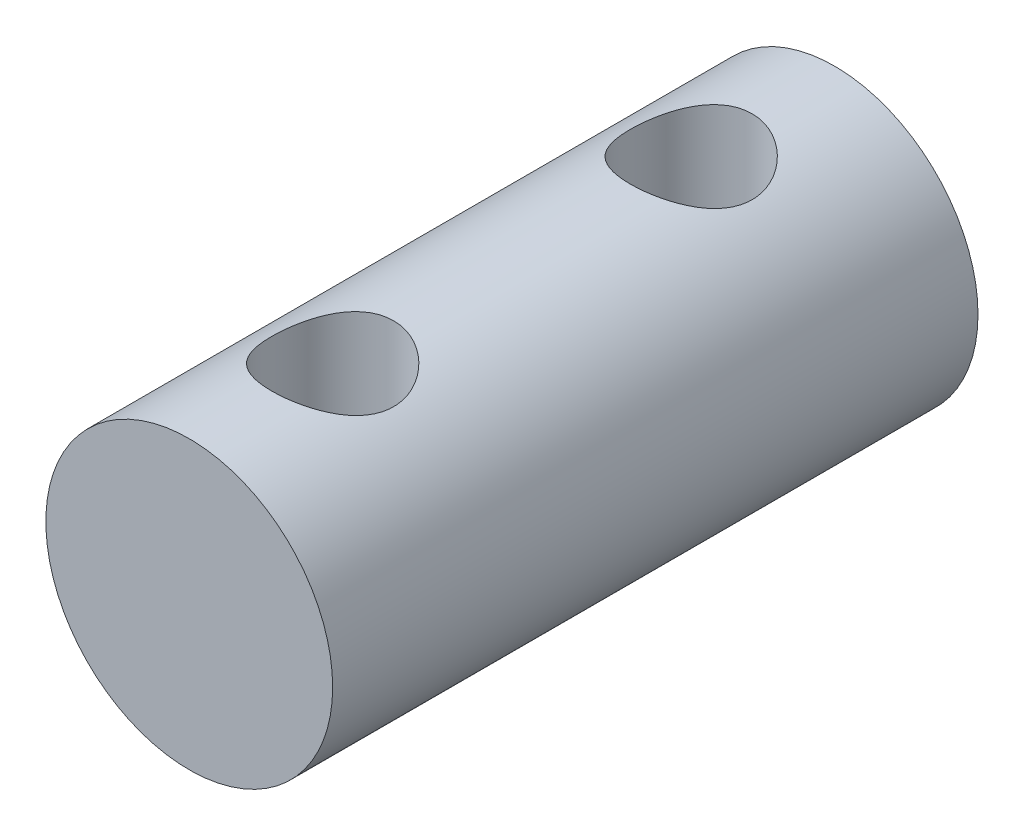
from build123d import *

# Parameters (mm, degrees)
SKETCH_1_R               = 4
EXTRUDE_1_DEPTH          = 18
CUT_EXTRUDE_1_DEPTH      = 10
CUT_EXTRUDE_1_DEPTH_BACK = 10
SKETCH_2_R               = 1.7


with BuildPart() as part:
    # 草图1 → 拉伸1 (new body)
    with BuildSketch(Plane.XY):
        Circle(SKETCH_1_R)
    extrude(amount=EXTRUDE_1_DEPTH)

    # 草图2 → 切除-拉伸1 (cut, two sides: drawn at the far end of the back side and taken through both)
    with BuildSketch(Plane(origin=(0, 0, 0), x_dir=(1, 0, 0), z_dir=(0, 1, 0)).offset(-CUT_EXTRUDE_1_DEPTH_BACK)):
        with Locations((0, -4)):
            Circle(SKETCH_2_R)
        with Locations((0, -14)):
            Circle(SKETCH_2_R)
    extrude(amount=CUT_EXTRUDE_1_DEPTH + CUT_EXTRUDE_1_DEPTH_BACK, mode=Mode.SUBTRACT)


solid = part.part
